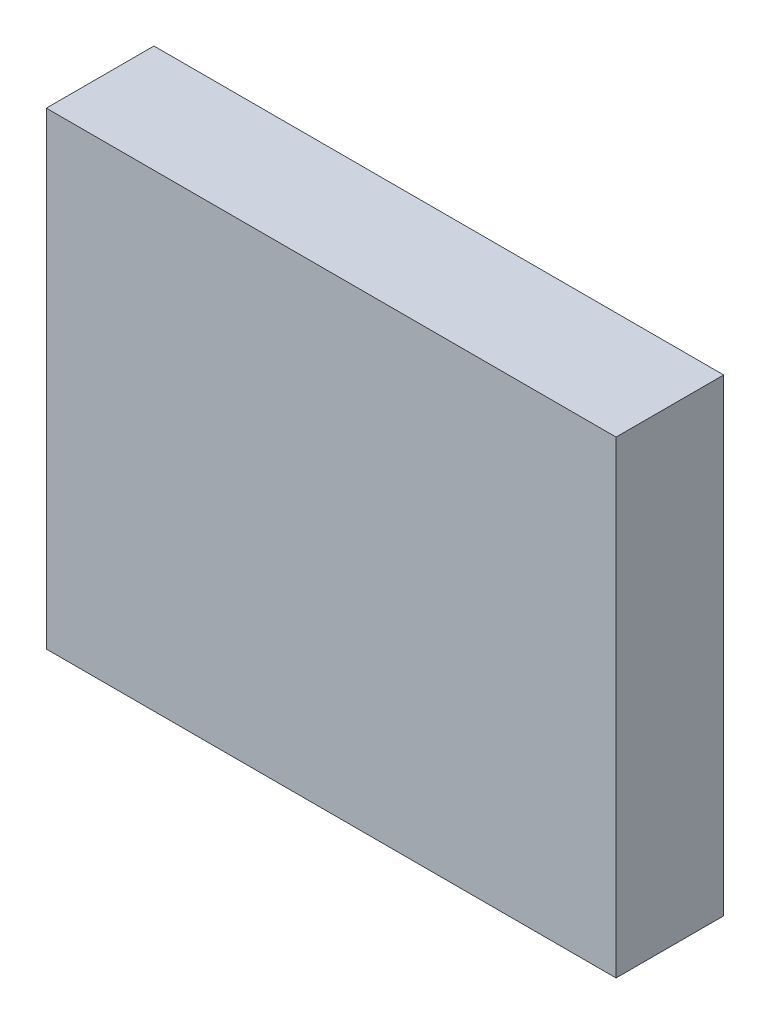
from build123d import *

# Parameters (mm, degrees)
SKETCH_1_W      = 45
SKETCH_1_H      = 37
EXTRUDE_1_DEPTH = 8.5


with BuildPart() as part:
    # 草图1 → 凸台-拉伸1 (new body)
    with BuildSketch(Plane.XY):
        with Locations((22.5, 18.5)):
            Rectangle(SKETCH_1_W, SKETCH_1_H)
    extrude(amount=EXTRUDE_1_DEPTH)


solid = part.part
